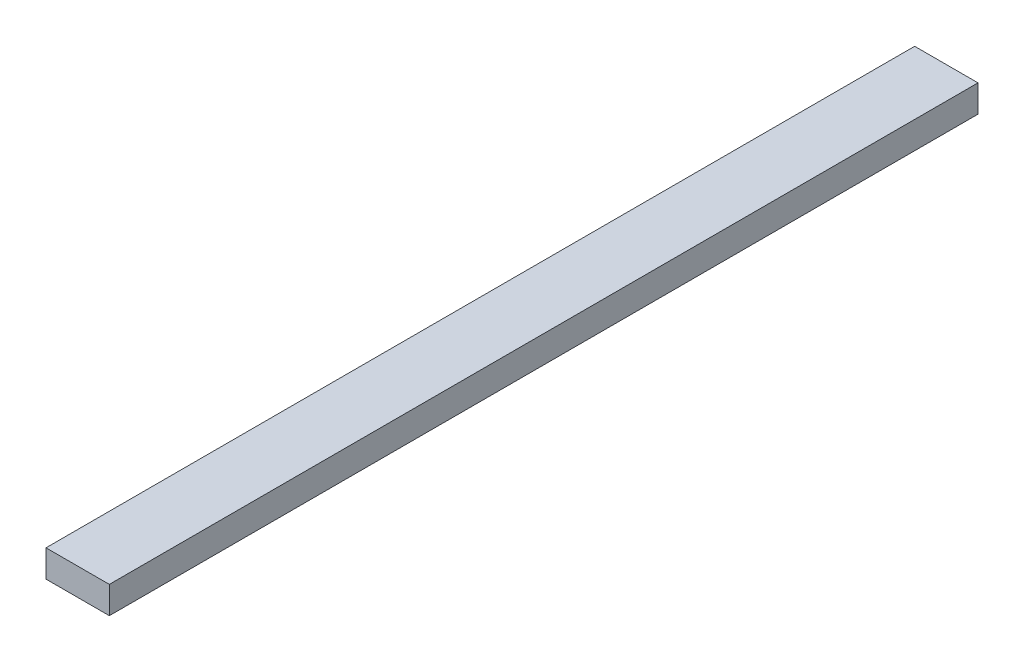
from build123d import *

# Parameters (mm, degrees)
SKETCH1_W           = 88.9
SKETCH1_H           = 38.1
BOSS_EXTRUDE1_DEPTH = 1219.2


with BuildPart() as part:
    # Sketch1 → Boss-Extrude1 (new body)
    with BuildSketch(Plane.XY):
        with Locations((44.45, -19.05)):
            Rectangle(SKETCH1_W, SKETCH1_H)
    extrude(amount=BOSS_EXTRUDE1_DEPTH)


solid = part.part
